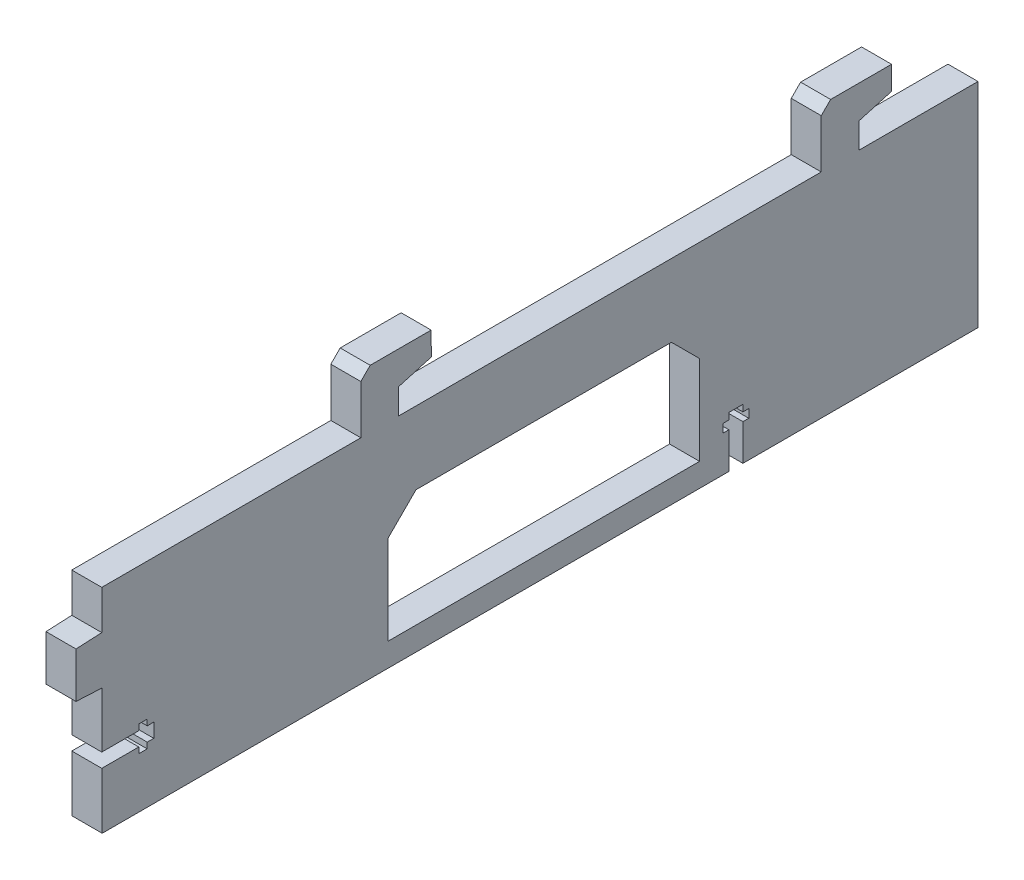
from build123d import *

# Parameters (mm, degrees)
BOSS_EXTRUDE1_DEPTH = 6.4


with BuildPart() as part:
    # Sketch1 → Boss-Extrude1 (new body)
    with BuildSketch(Plane(origin=(0, 0, 0), x_dir=(0, 0, -1), z_dir=(1, 0, 0))):
        Polygon((7.699451661, 16.299320413), (7.699451661, 15.050679587), (-0.190789953, 15.050679587), (-0.190789953, 26.875784077), (-5.692060153, 27.152292188), (-5.689519376, 36.852291855), (-0.190789953, 37.125784431), (-0.190789953, 45.489990555), (55.075, 45.489990555), (55.075, 55.887449255), (57.075, 57.887449255), (70.079421798, 57.887449255), (70.115, 52.889990555), (63.115, 50.9), (63.115, 45.489442951), (153.305, 45.490143945), (153.305, 55.887449255), (155.305, 57.887449255), (168.309421798, 57.887449255), (168.345, 52.889990555), (161.345, 50.9), (161.345, 45.489442951), (186.745000058, 45.489442951), (186.748098344, 0), (136.598098344, 0), (136.598098344, 7.7113021), (137.848098344, 7.7113021), (137.848098344, 9.5113021), (136.598098344, 9.5113021), (136.598098344, 10.9113021), (133.59673917, 10.9113021), (133.59673917, 9.5113021), (132.348098344, 9.5113021), (132.348098344, 7.7113021), (133.59673917, 7.7113021), (133.59673917, 0), (118.842364298, 0), (73.842364298, 0), (0, 0), (-0.190789953, 0.087763288), (-0.190789953, 12.049320413), (7.699451661, 12.049320413), (7.699451661, 10.799320413), (9.499451661, 10.799320413), (9.499451661, 12.049320413), (10.899451661, 12.049320413), (10.899451661, 15.050679587), (9.499451661, 15.050679587), (9.499451661, 16.299320413), align=None)
        Polygon((60.842364298, 5), (127.342364298, 5), (127.342364298, 24), (121.342364298, 30), (66.842364298, 30), (60.842364298, 24), align=None, mode=Mode.SUBTRACT)
    extrude(amount=BOSS_EXTRUDE1_DEPTH)


solid = part.part
